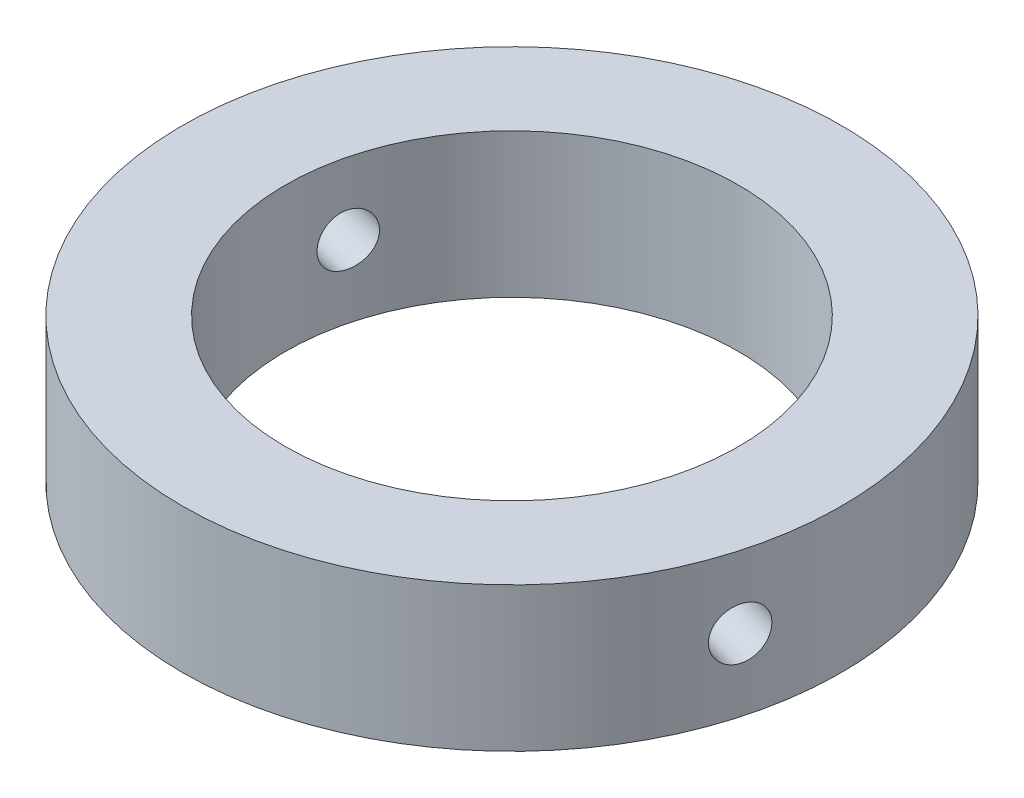
from build123d import *

# Parameters (mm, degrees)
SKETCH2_R                  = 16
SKETCH2_R_2                = 11
BOSS_EXTRUDE1_DEPTH        = 7
M3X0_5_TAPPED_HOLE1_REACH  = 39.437
M3X0_5_TAPPED_HOLE1_BORE_R = 1.25
M3X0_5_TAPPED_HOLE2_D      = 2.5
M3X0_5_TAPPED_HOLE2_DEPTH  = 3.248924226
M3X0_5_TAPPED_HOLE2_TIP    = 0.751075774


with BuildPart() as part:
    # Sketch2 → Boss-Extrude1 (new body)
    with BuildSketch(Plane(origin=(0, 0, 0), x_dir=(1, 0, 0), z_dir=(0, 1, 0))):
        with Locations(Location((0, 0, 0), (0, 0, 270))):
            Circle(SKETCH2_R)
        with Locations(Location((0, 0, 0), (0, 0, 270))):
            Circle(SKETCH2_R_2, mode=Mode.SUBTRACT)
    extrude(amount=BOSS_EXTRUDE1_DEPTH)

    # M3x0.5 Tapped Hole1 bore (on position points) → M3x0.5 Tapped Hole1 (cut, up to next)
    with BuildSketch(Plane(origin=(-15.520289871, 3.526588003, -3.888521866), x_dir=(0.243032616649, 0, -0.970018116967), z_dir=(-0.970018116967, 0, -0.243032616649)), mode=Mode.PRIVATE) as m3x0_5_tapped_hole1_sk1:
        Circle(M3X0_5_TAPPED_HOLE1_BORE_R)
    m3x0_5_tapped_hole1_tool1 = extrude(m3x0_5_tapped_hole1_sk1.sketch, amount=-M3X0_5_TAPPED_HOLE1_REACH, mode=Mode.PRIVATE) & part.part
    add(m3x0_5_tapped_hole1_tool1.solids().sort_by_distance((-15.52029, 3.526588, -3.888522))[0], mode=Mode.SUBTRACT)

    # M3x0.5 Tapped Hole2
    with Locations(Plane(origin=(15.411877549, 3.498112916, 4.298142669), x_dir=(-0.268633916838, 0, 0.963242346829), z_dir=(0.963242346829, 0, 0.268633916838))):
        with Locations((0, 0)):
            Hole(M3X0_5_TAPPED_HOLE2_D / 2, depth=M3X0_5_TAPPED_HOLE2_DEPTH)
            with Locations((0, 0, -(M3X0_5_TAPPED_HOLE2_DEPTH + M3X0_5_TAPPED_HOLE2_TIP / 2))):  # 118° drill point
                Cone(0, M3X0_5_TAPPED_HOLE2_D / 2, M3X0_5_TAPPED_HOLE2_TIP, mode=Mode.SUBTRACT)


solid = part.part
